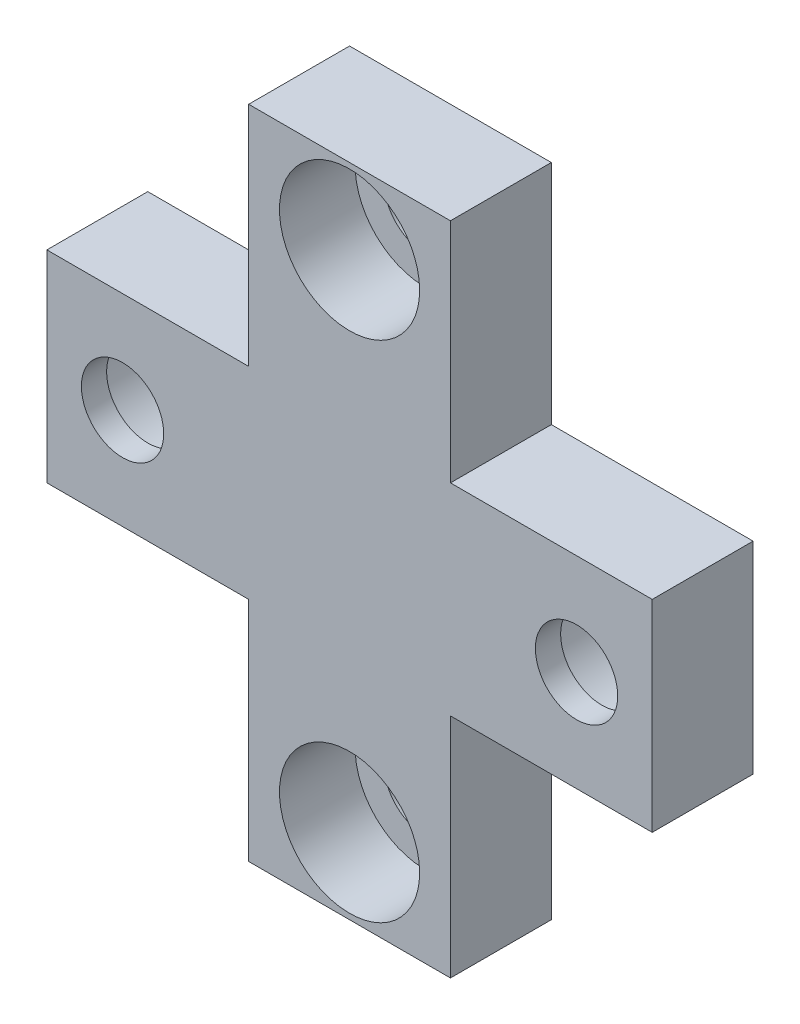
from build123d import *

# Parameters (mm, degrees)
SKETCH3_W                                      = 8
SKETCH3_H                                      = 26
SKETCH3_R                                      = 1
SKETCH3_W_2                                    = 24
SKETCH3_H_2                                    = 8
BOSS_EXTRUDE1_DEPTH                            = 4
CBORE_FOR_4_SOCKET_HEAD_CAP_SCREW2_D           = 3.2639
CBORE_FOR_4_SOCKET_HEAD_CAP_SCREW2_CBORE_D     = 5.55752
CBORE_FOR_4_SOCKET_HEAD_CAP_SCREW2_CBORE_DEPTH = 3.000000096
CBORE_FOR_4_SOCKET_HEAD_CAP_SCREW3_D           = 3.2639
CBORE_FOR_4_SOCKET_HEAD_CAP_SCREW3_CBORE_D     = 5.55752
CBORE_FOR_4_SOCKET_HEAD_CAP_SCREW3_CBORE_DEPTH = 3.000000096


with BuildPart() as part:
    # Sketch3 → Boss-Extrude1 (new body)
    # profile 1 of 2: a face of its own
    with BuildSketch(Plane.XY):
        with Locations((4, -13)):
            Rectangle(SKETCH3_W, SKETCH3_H)
        with Locations((4, -3)):
            Circle(SKETCH3_R, mode=Mode.SUBTRACT)
        with Locations((4, -23)):
            Circle(SKETCH3_R, mode=Mode.SUBTRACT)
    # profile 2 of 2: a face of its own
    with BuildSketch(Plane.XY):
        with Locations((4, -13)):
            Rectangle(SKETCH3_W_2, SKETCH3_H_2)
        with Locations((-5, -13)):
            Circle(SKETCH3_R, mode=Mode.SUBTRACT)
        with Locations((13, -13)):
            Circle(SKETCH3_R, mode=Mode.SUBTRACT)
    extrude(amount=BOSS_EXTRUDE1_DEPTH)

    # CBORE for #4 Socket Head Cap Screw2 (through all)
    with Locations(Plane(origin=(4, -3, 4), x_dir=(1, 0, 0), z_dir=(0, 0, 1))):
        with Locations((0, 0), (0, -20)):
            CounterBoreHole(CBORE_FOR_4_SOCKET_HEAD_CAP_SCREW2_D / 2, CBORE_FOR_4_SOCKET_HEAD_CAP_SCREW2_CBORE_D / 2, CBORE_FOR_4_SOCKET_HEAD_CAP_SCREW2_CBORE_DEPTH)

    # CBORE for #4 Socket Head Cap Screw3 (through all)
    with Locations(Plane(origin=(13, -13, 0), x_dir=(-1, 0, 0), z_dir=(0, 0, -1))):
        with Locations((0, 0), (18, 0)):
            CounterBoreHole(CBORE_FOR_4_SOCKET_HEAD_CAP_SCREW3_D / 2, CBORE_FOR_4_SOCKET_HEAD_CAP_SCREW3_CBORE_D / 2, CBORE_FOR_4_SOCKET_HEAD_CAP_SCREW3_CBORE_DEPTH)


solid = part.part
